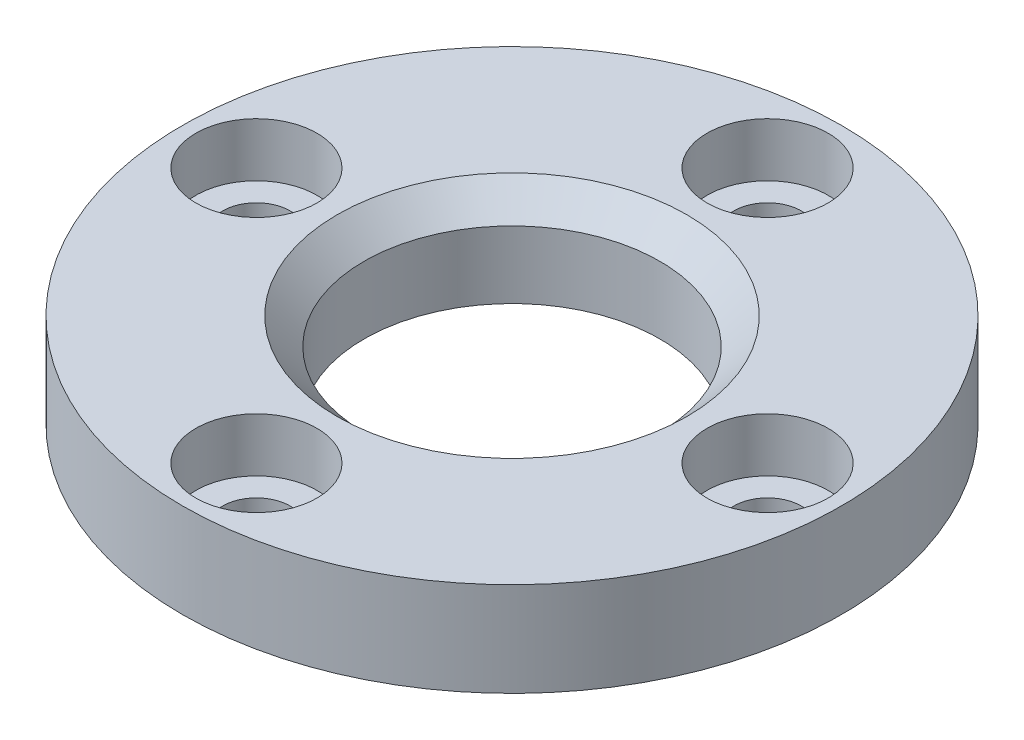
from build123d import *

# Parameters (mm, degrees)
SKETCH_1_R          = 12.25
SKETCH_1_R_2        = 5.5
SKETCH_1_R_3        = 1.25
EXTRUDE_1_DEPTH     = 3.5
SKETCH_2_R          = 2.25
CUT_EXTRUDE_1_DEPTH = 2
CHAMFER_1_SIZE      = 1


with BuildPart() as part:
    # Эскиз1 → Бобышка-Вытянуть1 (new body)
    with BuildSketch(Plane(origin=(0, 0, 0), x_dir=(1, 0, 0), z_dir=(0, 1, 0))):
        with Locations(Location((0, 0, 0), (0, 0, 270))):
            Circle(SKETCH_1_R)
        with Locations(Location((0, 0, 0), (0, 0, 270))):
            Circle(SKETCH_1_R_2, mode=Mode.SUBTRACT)
        with Locations(Location((0, 9.5, 0), (0, 0, 270))):
            Circle(SKETCH_1_R_3, mode=Mode.SUBTRACT)
        with Locations(Location((9.5, 0, 0), (0, 0, 270))):
            Circle(SKETCH_1_R_3, mode=Mode.SUBTRACT)
        with Locations(Location((0, -9.5, 0), (0, 0, 270))):
            Circle(SKETCH_1_R_3, mode=Mode.SUBTRACT)
        with Locations(Location((-9.5, 0, 0), (0, 0, 270))):
            Circle(SKETCH_1_R_3, mode=Mode.SUBTRACT)
    extrude(amount=EXTRUDE_1_DEPTH)

    # Эскиз2 → Вырез-Вытянуть1 (cut)
    with BuildSketch(Plane(origin=(0, 3.5, 0), x_dir=(1, 0, 0), z_dir=(0, 1, 0))):
        with Locations(Location((0, 9.5, 0), (0, 0, 270))):
            Circle(SKETCH_2_R)
        with Locations(Location((9.5, 0, 0), (0, 0, 270))):
            Circle(SKETCH_2_R)
        with Locations(Location((0, -9.5, 0), (0, 0, 270))):
            Circle(SKETCH_2_R)
        with Locations(Location((-9.5, 0, 0), (0, 0, 270))):
            Circle(SKETCH_2_R)
    extrude(amount=-CUT_EXTRUDE_1_DEPTH, mode=Mode.SUBTRACT)

    # Фаска1
    chamfer_1_edges = [part.edges().sort_by_distance(p)[0] for p in [
        (0, 3.5, -5.5),
    ]]
    chamfer(chamfer_1_edges, length=CHAMFER_1_SIZE)


solid = part.part
